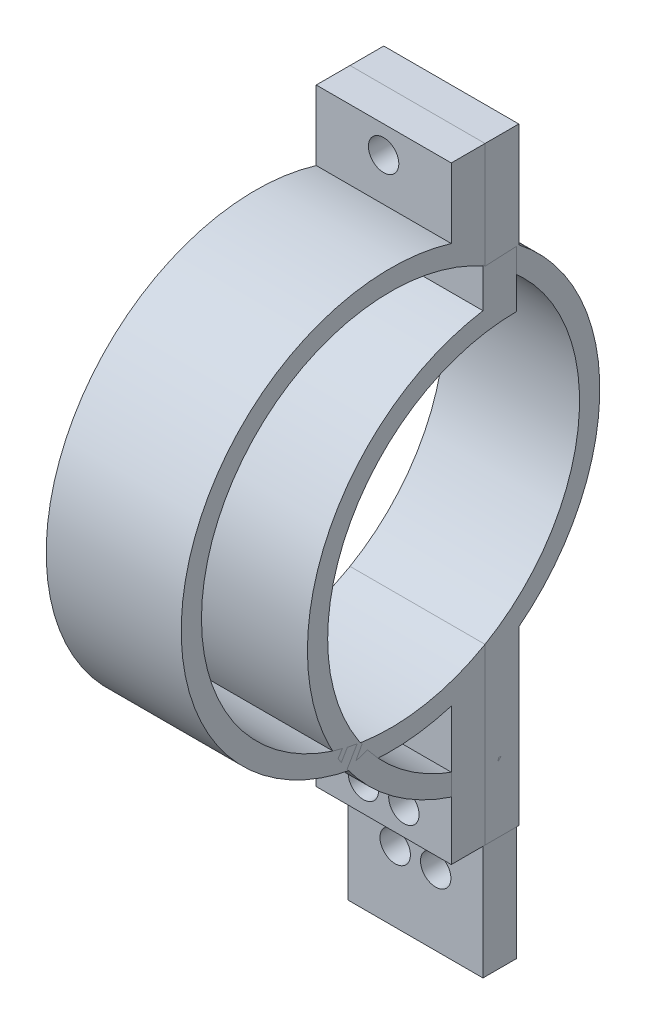
from build123d import *

# Parameters (mm, degrees)
BOSS_EXTRUDE1_DEPTH = 20
SKETCH3_W           = 20
SKETCH3_H           = 5
BOSS_EXTRUDE2_DEPTH = 10
SKETCH2_R           = 2.25
CUT_EXTRUDE1_DEPTH  = 10
BOSS_EXTRUDE3_DEPTH = 20
BOSS_EXTRUDE4_DEPTH = 20
SKETCH5_R           = 2.25
CUT_EXTRUDE2_DEPTH  = 20


with BuildPart() as part:
    # Sketch1 → Boss-Extrude1 (new body)
    with BuildSketch(Plane.YZ):
        with BuildLine():
            ThreePointArc((-28, 0), (0, 28), (28, 0))
            Line((28, 0), (45, 0))
            Line((45, 0), (45, 5))
            Line((45, 5), (30.594117082, 5))
            ThreePointArc((30.594117082, 5), (0, 31), (-30.594117082, 5))
            Line((-30.594117082, 5), (-45, 5))
            Line((-45, 5), (-45, 0))
            Line((-45, 0), (-28, 0))
        make_face()
    extrude(amount=BOSS_EXTRUDE1_DEPTH)

    # Sketch3 → Boss-Extrude2 (add)
    with BuildSketch(Plane.XZ.offset(45)):
        with Locations((10, 2.5)):
            Rectangle(SKETCH3_W, SKETCH3_H)
    extrude(amount=BOSS_EXTRUDE2_DEPTH)

    # Sketch2 → Cut-Extrude1 (cut)
    with BuildSketch(Plane.XY.offset(5)):
        with Locations((7, -44.594117082)):
            Circle(SKETCH2_R)
        with Locations((10, 37.947426475)):
            Circle(SKETCH2_R)
        with Locations((13, -44.594117082)):
            Circle(SKETCH2_R)
    extrude(amount=-CUT_EXTRUDE1_DEPTH, mode=Mode.SUBTRACT)


with BuildPart() as body_2:
    # Sketch4 → Boss-Extrude3 (new body)
    with BuildSketch(Plane.YZ):
        with BuildLine():
            Line((51.89594566, 4.691811125), (51.89594566, 9.691811125))
            Line((51.89594566, 9.691811125), (41.560739608, 9.691811125))
            ThreePointArc((41.560739608, 9.691811125), (11.89594566, 49.691811125), (-17.768848289, 9.691811125))
            Line((-17.768848289, 9.691811125), (-38.10405434, 9.691811125))
            Line((-38.10405434, 9.691811125), (-38.10405434, 4.691811125))
            Line((-38.10405434, 4.691811125), (-12.352765646, 4.691811125))
            ThreePointArc((-12.352765646, 4.691811125), (11.89594566, 46.691811125), (36.144656966, 4.691811125))
            Line((36.144656966, 4.691811125), (51.89594566, 4.691811125))
        make_face()
    extrude(amount=BOSS_EXTRUDE3_DEPTH)


with BuildPart() as body_3:
    # Sketch4<3> → Boss-Extrude4 (new body)
    with BuildSketch(Plane.YZ):
        with BuildLine():
            Line((51.89594566, -0.308188875), (51.89594566, 4.691811125))
            Line((51.89594566, 4.691811125), (36.144656966, 4.691811125))
            ThreePointArc((36.144656966, 4.691811125), (11.89594566, -9.308188875), (-12.352765646, 4.691811125))
            Line((-12.352765646, 4.691811125), (-38.10405434, 4.691811125))
            Line((-38.10405434, 4.691811125), (-38.10405434, -0.308188875))
            Line((-38.10405434, -0.308188875), (-12.598951768, -0.308188875))
            ThreePointArc((-12.598951768, -0.308188875), (11.89594566, -12.308188875), (36.390843088, -0.308188875))
            Line((36.390843088, -0.308188875), (51.89594566, -0.308188875))
        make_face()
    extrude(amount=BOSS_EXTRUDE4_DEPTH)


with BuildPart() as cut_extrude2_tool:
    # Sketch5 → Cut-Extrude2 (new body)
    with BuildSketch(Plane.XY.offset(9.691811125)):
        with Locations((6.979433218, -34.02668172)):
            Circle(SKETCH5_R)
        with Locations((9.979433218, 47.89594566)):
            Circle(SKETCH5_R)
        with Locations((12.979433218, -34.10405434)):
            Circle(SKETCH5_R)
    extrude(amount=-CUT_EXTRUDE2_DEPTH)


with BuildPart() as body_2_1:
    add(body_2.part)

    # Cut-Extrude2: cut by cut_extrude2_tool
    add(cut_extrude2_tool.part, mode=Mode.SUBTRACT)


with BuildPart() as body_3_1:
    add(body_3.part)

    # Cut-Extrude2: cut by cut_extrude2_tool
    add(cut_extrude2_tool.part, mode=Mode.SUBTRACT)


solid = Compound([part.part, body_2_1.part, body_3_1.part])
